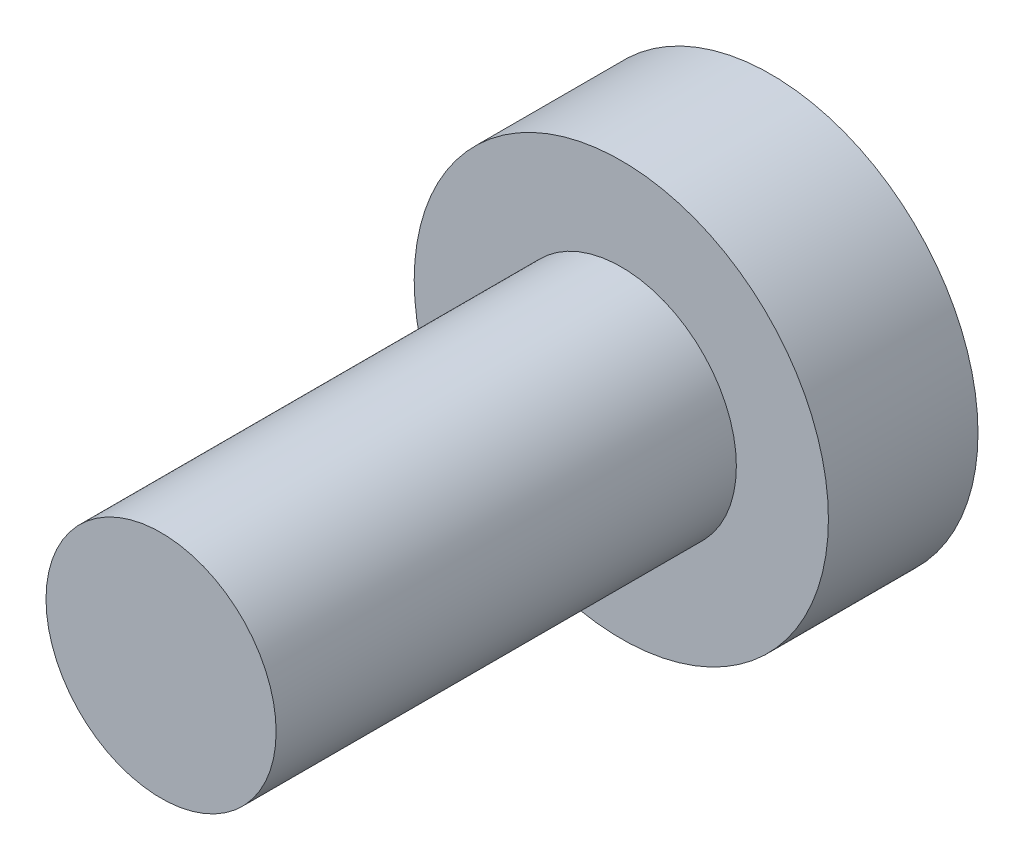
from build123d import *

# Parameters (mm, degrees)
SKETCH_1_R      = 1.8
EXTRUDE_1_DEPTH = 1.3
SKETCH_2_R      = 1
EXTRUDE_2_DEPTH = 4


with BuildPart() as part:
    # Эскиз1 → Бобышка-Вытянуть1 (new body)
    with BuildSketch(Plane.XY):
        Circle(SKETCH_1_R)
    extrude(amount=EXTRUDE_1_DEPTH)

    # Эскиз2 → Бобышка-Вытянуть2 (add)
    with BuildSketch(Plane.XY.offset(1.3)):
        Circle(SKETCH_2_R)
    extrude(amount=EXTRUDE_2_DEPTH)


solid = part.part
